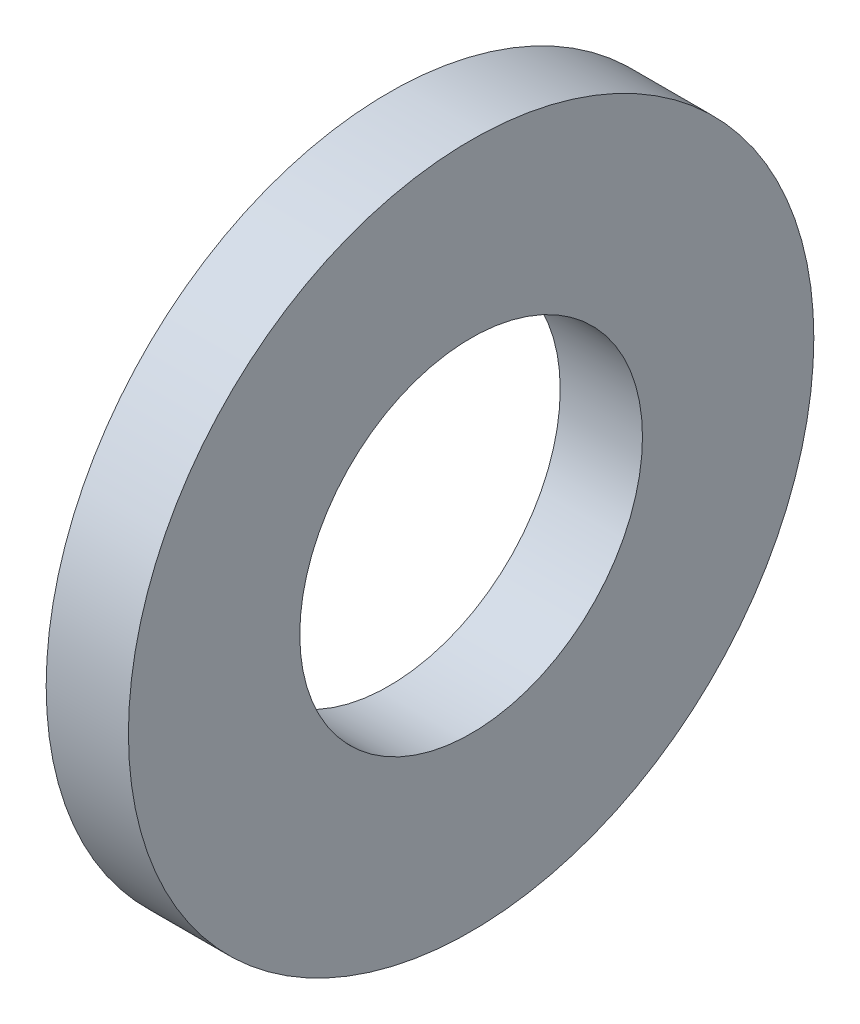
from build123d import *

# Parameters (mm, degrees)
SKETCH1_R           = 9.525
SKETCH1_R_2         = 4.7625
BOSS_EXTRUDE1_DEPTH = 2.286


with BuildPart() as part:
    # Sketch1 → Boss-Extrude1 (new body)
    with BuildSketch(Plane(origin=(0, 0, 0), x_dir=(0, 0, -1), z_dir=(1, 0, 0))):
        Circle(SKETCH1_R)
        Circle(SKETCH1_R_2, mode=Mode.SUBTRACT)
    extrude(amount=BOSS_EXTRUDE1_DEPTH)


solid = part.part
